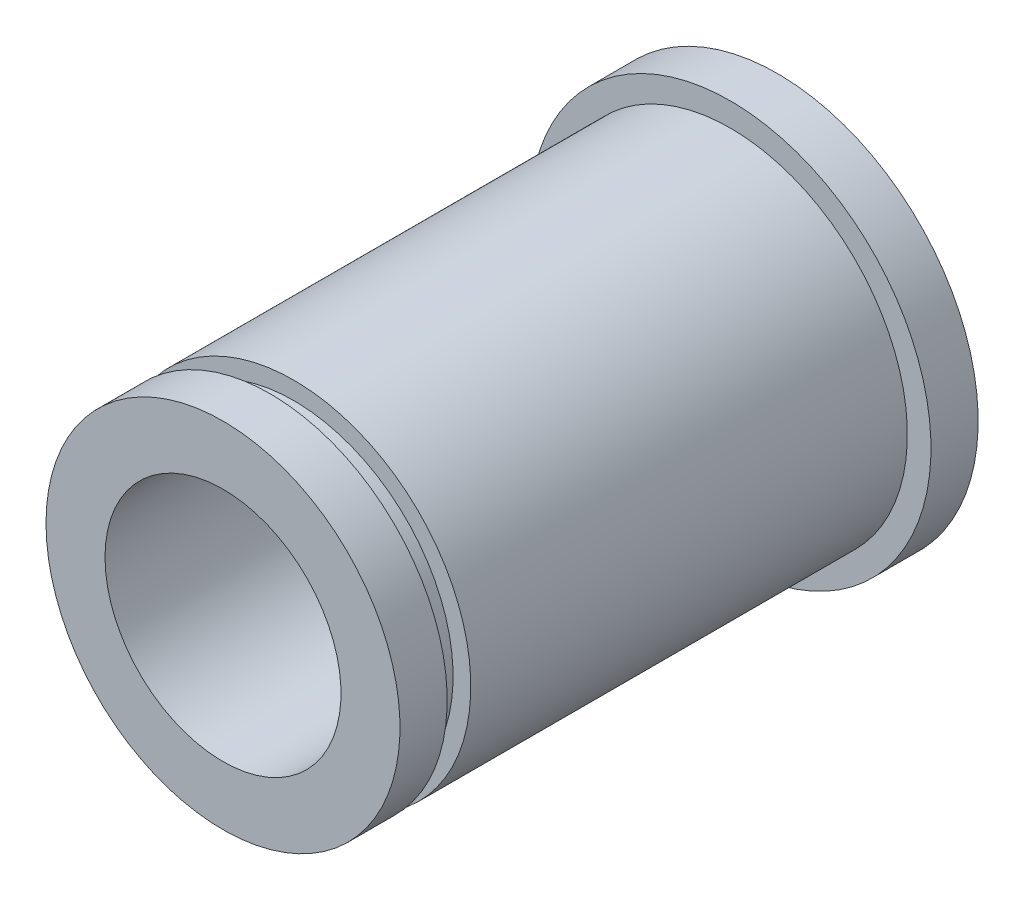
from build123d import *


with BuildPart() as part:
    # Sketch1 → Revolve1 (revolve)
    with BuildSketch(Plane(origin=(0, 0, 0), x_dir=(1, 0, 0), z_dir=(0, 1, 0)), mode=Mode.PRIVATE) as revolve1_sk:
        Polygon((5, 2), (5, -21.5), (7.5, -21.5), (7.5, -19.5), (6.75, -19.5), (6.75, -18.5), (7.5, -18.5), (7.5, 0), (8.5, 0), (8.5, 2), align=None)
    revolve(revolve1_sk.sketch.rotate(Axis((0, 0, -1.437264446), (0, 0, 1)), 180), axis=Axis((0, 0, -1.437264446), (0, 0, 1)))


solid = part.part
